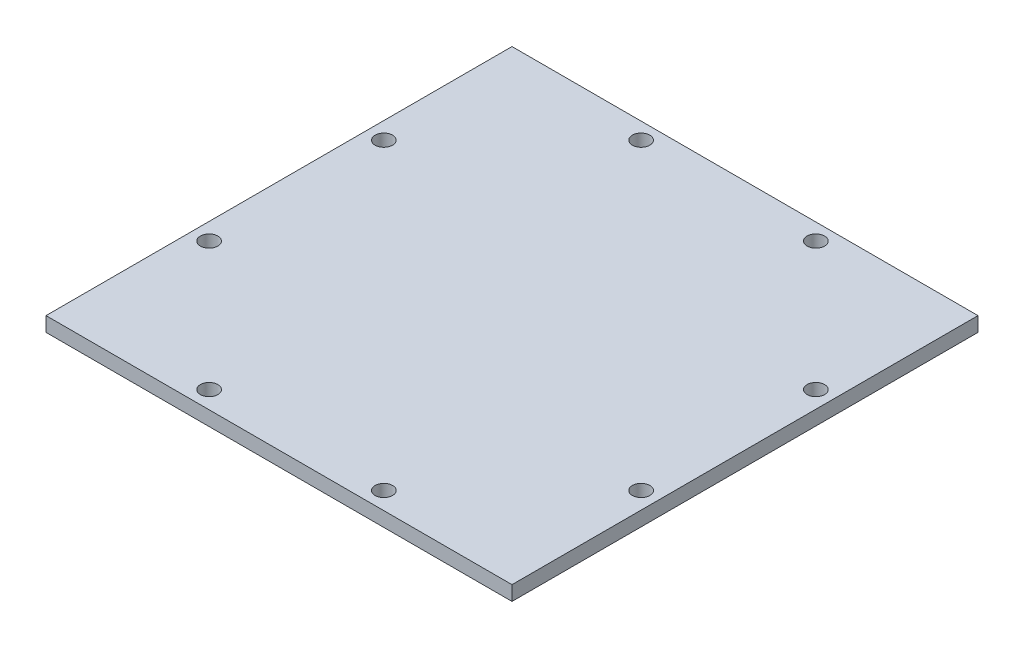
from build123d import *

# Parameters (mm, degrees)
SKETCH_1_W               = 80
SKETCH_1_H               = 80
EXTRUDE_1_DEPTH          = 2.5
SKETCH_2_R               = 1.5
CUT_EXTRUDE_1_DEPTH      = 10
PATTERN_CIRCULAR_1_COUNT = 4


with BuildPart() as part:
    # Эскиз1 → Бобышка-Вытянуть1 (new body)
    with BuildSketch(Plane(origin=(0, 0, 0), x_dir=(1, 0, 0), z_dir=(0, 1, 0))):
        Rectangle(SKETCH_1_W, SKETCH_1_H)
    extrude(amount=EXTRUDE_1_DEPTH)

    # Эскиз2 → Вырез-Вытянуть1 (cut)
    with BuildSketch(Plane(origin=(0, 2.5, 0), x_dir=(1, 0, 0), z_dir=(0, 1, 0))):
        with Locations(Location((-15, -37, 0), (0, 0, 270))):
            Circle(SKETCH_2_R)
        with Locations(Location((15, -37, 0), (0, 0, 270))):
            Circle(SKETCH_2_R)
    cut_extrude_1 = extrude(amount=-CUT_EXTRUDE_1_DEPTH, mode=Mode.SUBTRACT)

    # Круговой массив1: Вырез-Вытянуть1 ×4 about axis
    pattern_circular_1_axis = Axis((0, 0, -0.081911433), (0, 1, 0))
    for i in range(1, PATTERN_CIRCULAR_1_COUNT):
        add(cut_extrude_1.rotate(pattern_circular_1_axis, i * 360 / PATTERN_CIRCULAR_1_COUNT), mode=Mode.SUBTRACT)


solid = part.part
